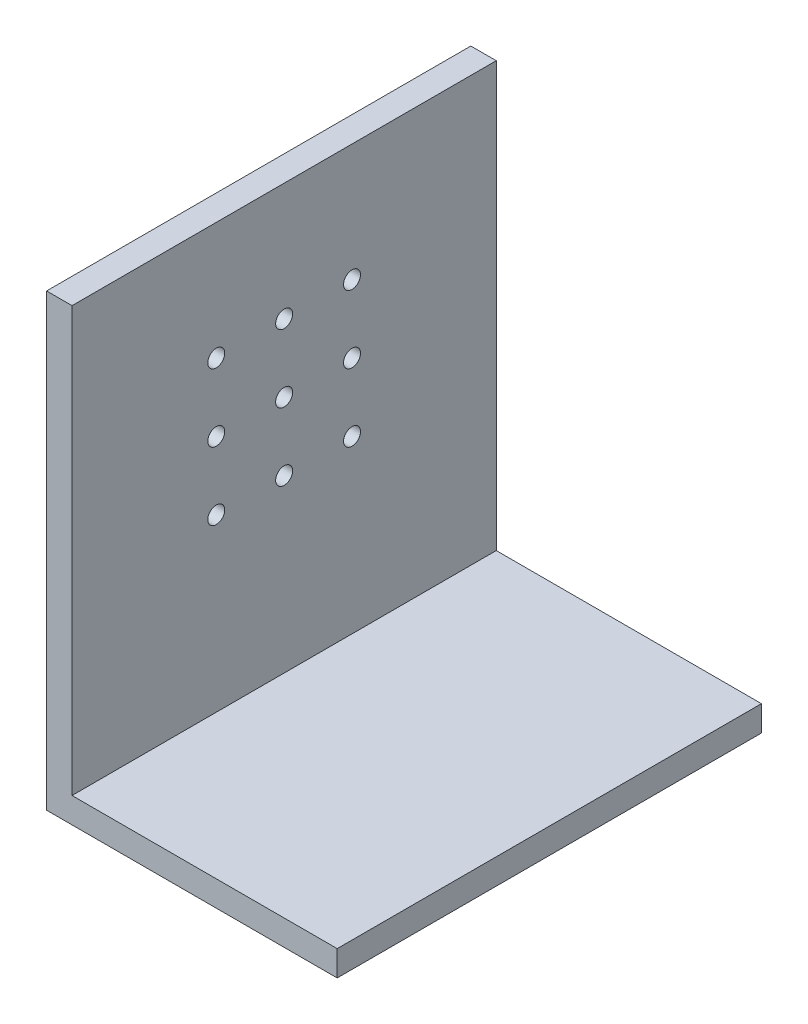
from build123d import *

# Parameters (mm, degrees)
SKETCH_1_W                       = 34.251173864
SKETCH_1_H                       = 50
EXTRUDE_1_DEPTH                  = 3
SKETCH_2_W                       = 3
SKETCH_2_H                       = 50
EXTRUDE_2_DEPTH                  = 50
SKETCH_3_R                       = 1
CUT_EXTRUDE_1_DEPTH              = 50
PATTERN_LINEAR_1_COUNT           = 3
PATTERN_LINEAR_1_PITCH           = 8
PATTERN_LINEAR_2_COUNT           = 3
PATTERN_LINEAR_2_PITCH           = 8
PATTERN_LINEAR_2_COPY_1_SKETCH_R = 1
PATTERN_LINEAR_2_COPY_1_DEPTH    = 50
PATTERN_LINEAR_2_COPY_2_SKETCH_R = 1
PATTERN_LINEAR_2_COPY_2_DEPTH    = 50
PATTERN_LINEAR_2_COPY_3_SKETCH_R = 1
PATTERN_LINEAR_2_COPY_3_DEPTH    = 50
PATTERN_LINEAR_2_COPY_4_SKETCH_R = 1
PATTERN_LINEAR_2_COPY_4_DEPTH    = 50


with BuildPart() as part:
    # 草图1 → 凸台-拉伸1 (new body)
    with BuildSketch(Plane(origin=(0, 0, 0), x_dir=(1, 0, 0), z_dir=(0, 1, 0))):
        with Locations((17.125586932, 0)):
            Rectangle(SKETCH_1_W, SKETCH_1_H)
    extrude(amount=EXTRUDE_1_DEPTH)

    # 草图2 → 凸台-拉伸2 (add)
    with BuildSketch(Plane(origin=(0, 3, 0), x_dir=(1, 0, 0), z_dir=(0, 1, 0))):
        with Locations((1.5, 0)):
            Rectangle(SKETCH_2_W, SKETCH_2_H)
    extrude(amount=EXTRUDE_2_DEPTH)

    # 草图3 → 切除-拉伸1 (cut)
    with BuildSketch(Plane.ZY):
        with Locations((-8, 39.156069013)):
            Circle(SKETCH_3_R)
    cut_extrude_1 = extrude(amount=-CUT_EXTRUDE_1_DEPTH, mode=Mode.SUBTRACT)

    # 阵列(线性)1: 切除-拉伸1 ×3
    with Locations(*[(0, 0, i * PATTERN_LINEAR_1_PITCH) for i in range(1, PATTERN_LINEAR_1_COUNT)]):
        add(cut_extrude_1, mode=Mode.SUBTRACT)

    # 阵列(线性)2: 切除-拉伸1 ×3
    with Locations(*[(0, -i * PATTERN_LINEAR_2_PITCH, 0) for i in range(1, PATTERN_LINEAR_2_COUNT)]):
        add(cut_extrude_1, mode=Mode.SUBTRACT)

    # 阵列(线性)2 copy 1 sketch → 阵列(线性)2 copy 1 (cut)
    with BuildSketch(Plane(origin=(0, -8, 8), x_dir=(0, 0, 1), z_dir=(-1, 0, 0))):
        with Locations((-8, 39.156069013)):
            Circle(PATTERN_LINEAR_2_COPY_1_SKETCH_R)
    extrude(amount=-PATTERN_LINEAR_2_COPY_1_DEPTH, mode=Mode.SUBTRACT)

    # 阵列(线性)2 copy 2 sketch → 阵列(线性)2 copy 2 (cut)
    with BuildSketch(Plane(origin=(0, -16, 8), x_dir=(0, 0, 1), z_dir=(-1, 0, 0))):
        with Locations((-8, 39.156069013)):
            Circle(PATTERN_LINEAR_2_COPY_2_SKETCH_R)
    extrude(amount=-PATTERN_LINEAR_2_COPY_2_DEPTH, mode=Mode.SUBTRACT)

    # 阵列(线性)2 copy 3 sketch → 阵列(线性)2 copy 3 (cut)
    with BuildSketch(Plane(origin=(0, -8, 16), x_dir=(0, 0, 1), z_dir=(-1, 0, 0))):
        with Locations((-8, 39.156069013)):
            Circle(PATTERN_LINEAR_2_COPY_3_SKETCH_R)
    extrude(amount=-PATTERN_LINEAR_2_COPY_3_DEPTH, mode=Mode.SUBTRACT)

    # 阵列(线性)2 copy 4 sketch → 阵列(线性)2 copy 4 (cut)
    with BuildSketch(Plane(origin=(0, -16, 16), x_dir=(0, 0, 1), z_dir=(-1, 0, 0))):
        with Locations((-8, 39.156069013)):
            Circle(PATTERN_LINEAR_2_COPY_4_SKETCH_R)
    extrude(amount=-PATTERN_LINEAR_2_COPY_4_DEPTH, mode=Mode.SUBTRACT)


solid = part.part
